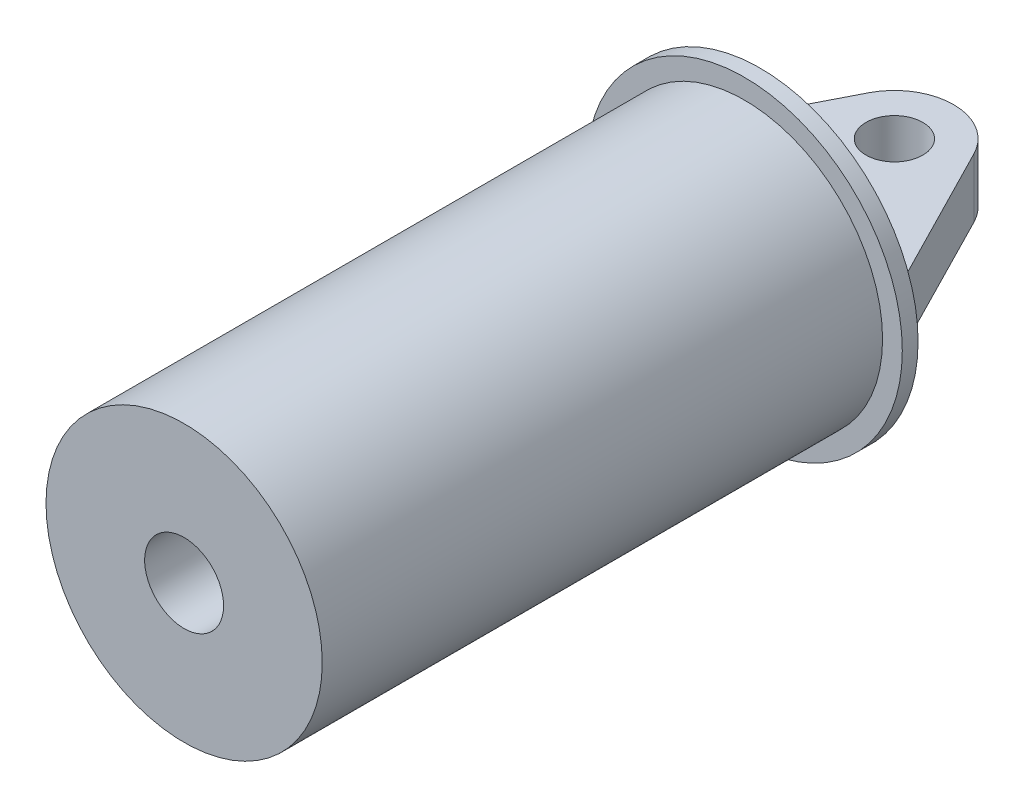
from build123d import *

# Parameters (mm, degrees)
SKETCH1_R           = 12.7
SKETCH1_R_2         = 11.1125
SKETCH1_R_3         = 3.175
BOSS_EXTRUDE1_DEPTH = 2.54
SKETCH1_3_R         = 11.1125
SKETCH1_3_R_2       = 3.175
BOSS_EXTRUDE2_DEPTH = 47.625
CHAMFER1_SIZE       = 2.54
CHAMFER1_SIZE2      = 1.27
SKETCH2_R           = 2.286
BOSS_EXTRUDE3_DEPTH = 2.38125
FILLET1_R           = 3.175
FILLET2_R           = 3.175


with BuildPart() as part:
    # Sketch1 → Boss-Extrude1 (new body)
    # profile 1 of 3: a face of its own
    with BuildSketch(Plane.XY):
        Circle(SKETCH1_R)
        Circle(SKETCH1_R_2, mode=Mode.SUBTRACT)
    # profile 2 of 3: a face of its own
    with BuildSketch(Plane.XY):
        Circle(SKETCH1_R_2)
        Circle(SKETCH1_R_3, mode=Mode.SUBTRACT)
    # profile 3 of 3: a face of its own
    with BuildSketch(Plane.XY):
        Circle(SKETCH1_R_3)
    extrude(amount=BOSS_EXTRUDE1_DEPTH)

    # Sketch1<3> → Boss-Extrude2 (add)
    with BuildSketch(Plane.XY):
        Circle(SKETCH1_3_R)
        Circle(SKETCH1_3_R_2, mode=Mode.SUBTRACT)
    extrude(amount=BOSS_EXTRUDE2_DEPTH)

    # Chamfer1
    chamfer1_edges = [part.edges().sort_by_distance(p)[0] for p in [
        (-12.7, 0, 0),
    ]]
    chamfer1_side = [part.faces().sort_by_distance(p)[0] for p in [
        (0, 0, 0),
    ]]
    chamfer(chamfer1_edges, length=CHAMFER1_SIZE, length2=CHAMFER1_SIZE2, reference=chamfer1_side[0])

    # Sketch2 → Boss-Extrude3 (add, symmetric)
    with BuildSketch(Plane(origin=(0, 0, 0), x_dir=(1, 0, 0), z_dir=(0, 1, 0))):
        with BuildLine():
            Line((-4.240295204, 11.693248793), (-11.1125, -1.74625))
            Line((-11.1125, -1.74625), (11.1125, -1.74625))
            Line((11.1125, -1.74625), (4.240295204, 11.693248793))
            ThreePointArc((4.240295204, 11.693248793), (0, 14.2875), (-4.240295204, 11.693248793))
        make_face()
        with Locations(Location((0, 9.525, 0), (0, 0, 90))):
            Circle(SKETCH2_R, mode=Mode.SUBTRACT)
    extrude(amount=BOSS_EXTRUDE3_DEPTH, both=True)

    # Fillet1
    fillet1_edges = [part.edges().sort_by_distance(p)[0] for p in [
        (10.263836295, -1.194873852, 0.086576696),
        (-10.240026318, 0, 0.040013159),
        (10.263836295, 1.194873852, 0.086576696),
    ]]
    fillet(fillet1_edges, radius=FILLET1_R)

    # Fillet2
    fillet2_edges = [part.edges().sort_by_distance(p)[0] for p in [
        (0, 2.38125, 0),
        (0, -2.38125, 0),
    ]]
    fillet(fillet2_edges, radius=FILLET2_R)


solid = part.part
